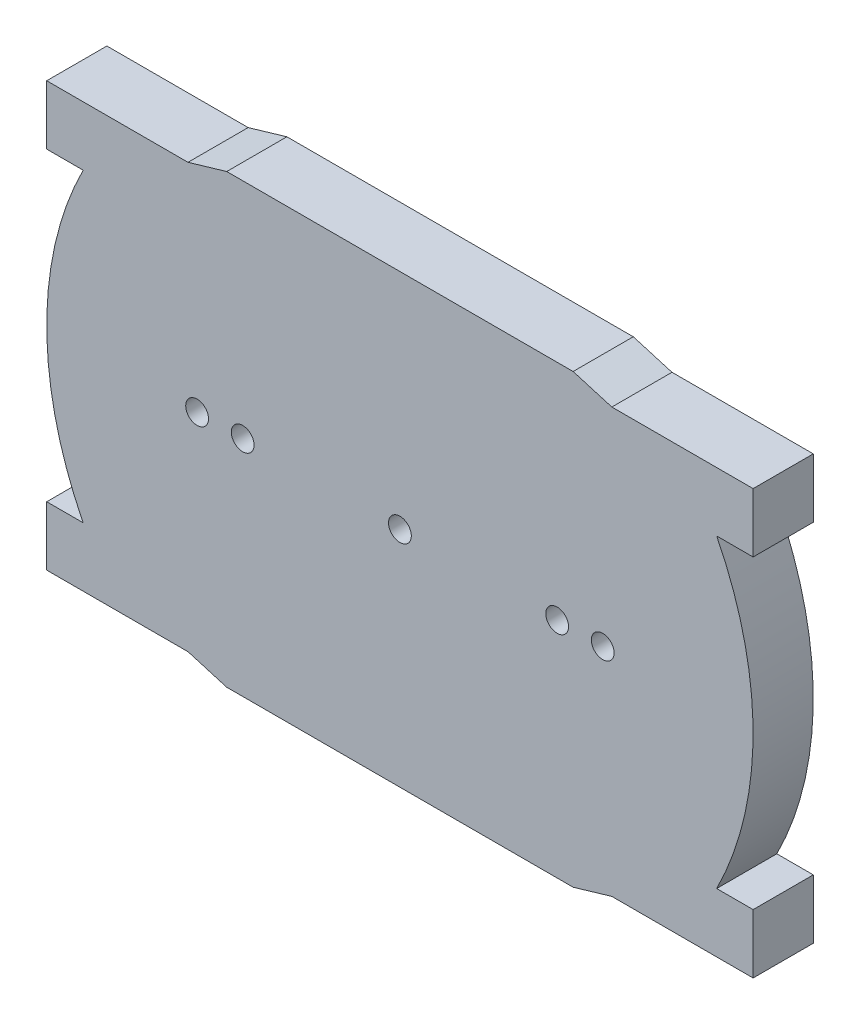
from build123d import *

# Parameters (mm, degrees)
SKETCH_1_W          = 155
SKETCH_1_H          = 98
EXTRUDE_1_DEPTH     = 13.2
CUT_EXTRUDE_1_DEPTH = 93.636331965
CUT_EXTRUDE_2_DEPTH = 93.636331965
SKETCH_4_R          = 2.5
CUT_EXTRUDE_3_DEPTH = 13.2


with BuildPart() as part:
    # 草图1 → 凸台-拉伸1 (new body)
    with BuildSketch(Plane.XY):
        Rectangle(SKETCH_1_W, SKETCH_1_H)
    extrude(amount=EXTRUDE_1_DEPTH)

    # 草图2 → 切除-拉伸1 (cut, through all)
    with BuildSketch(Plane.XY.offset(13.2)):
        Polygon((-38, 49), (-46.5, 46.5), (-77.5, 46.5), (-77.5, 49), align=None)
        Polygon((77.5, 49), (38, 49), (46.5, 46.5), (77.5, 46.5), align=None)
        Polygon((38, -49), (46.5, -46.5), (77.5, -46.5), (77.5, -49), align=None)
        Polygon((-77.5, -49), (-38, -49), (-46.5, -46.5), (-77.5, -46.5), align=None)
    extrude(amount=-CUT_EXTRUDE_1_DEPTH, mode=Mode.SUBTRACT)

    # 草图3 → 切除-拉伸2 (cut, through all)
    with BuildSketch(Plane.XY.offset(13.2)):
        with BuildLine():
            Line((-77.5, -33.5), (-69.5, -33.5))
            ThreePointArc((-69.5, -33.5), (-77.49, 0), (-69.5, 33.5))
            Line((-69.5, 33.5), (-77.5, 33.5))
            Line((-77.5, 33.5), (-77.5, -33.5))
        make_face()
        with BuildLine():
            Line((77.5, -33.5), (77.5, 33.5))
            Line((77.5, 33.5), (69.5, 33.5))
            ThreePointArc((69.5, 33.5), (77.49, 0), (69.5, -33.5))
            Line((69.5, -33.5), (77.5, -33.5))
        make_face()
    extrude(amount=-CUT_EXTRUDE_2_DEPTH, mode=Mode.SUBTRACT)

    # 草图4 → 切除-拉伸3 (cut)
    with BuildSketch(Plane(origin=(0, 0, 0), x_dir=(-1, 0, 0), z_dir=(0, 0, -1))):
        with Locations((-44.5, 0)):
            Circle(SKETCH_4_R)
        with Locations((-34.5, 0)):
            Circle(SKETCH_4_R)
        Circle(SKETCH_4_R)
        with Locations(Location((34.5, 0, 0), (0, 0, 180))):
            Circle(SKETCH_4_R)
        with Locations(Location((44.5, 0, 0), (0, 0, 180))):
            Circle(SKETCH_4_R)
    extrude(amount=-CUT_EXTRUDE_3_DEPTH, mode=Mode.SUBTRACT)


solid = part.part
